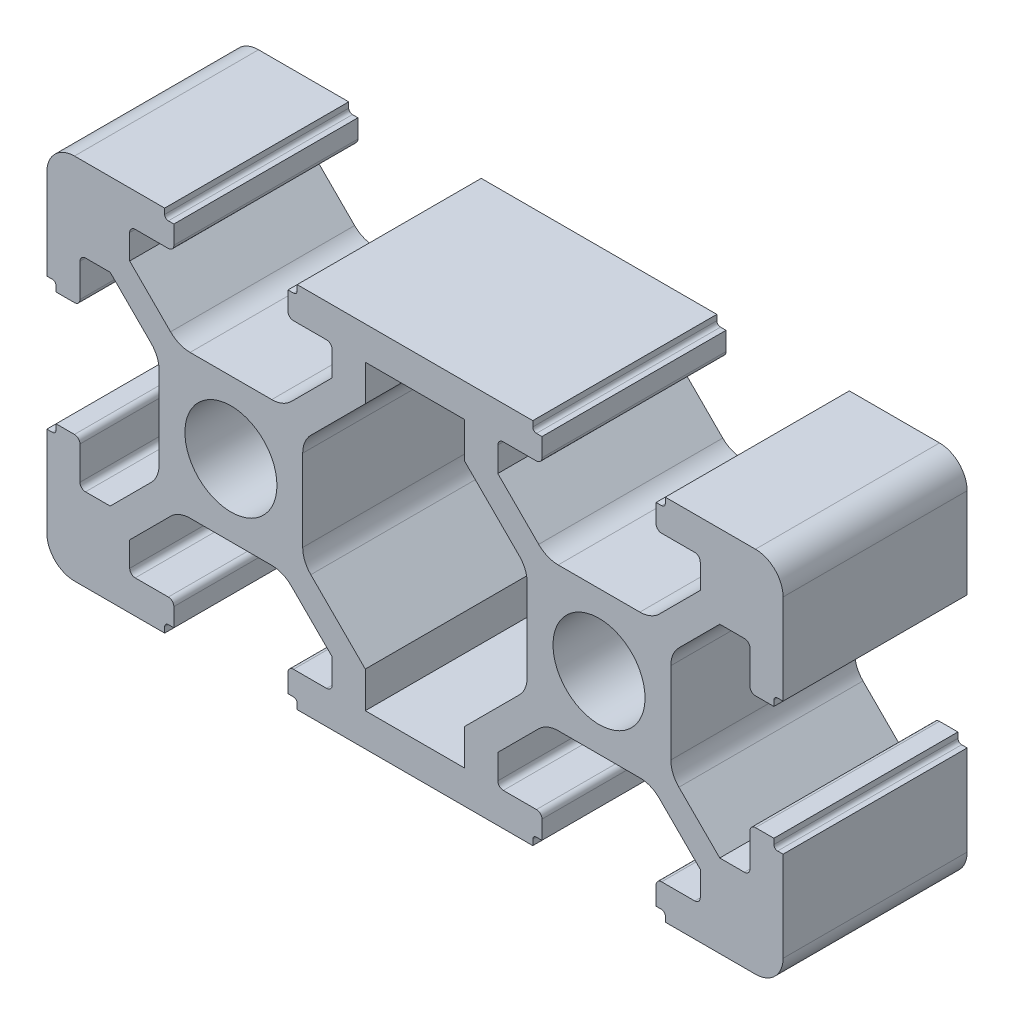
from build123d import *

# Parameters (mm, degrees)
SKETCH_1_R      = 2.5
EXTRUDE_1_DEPTH = 10


with BuildPart() as part:
    # 草图1 → 凸台-拉伸1 (new body)
    with BuildSketch(Plane.XY):
        with BuildLine():
            Line((-0.771587854, 9.545792426), (-5.671587854, 9.545792426))
            Line((-5.671587854, 9.545792426), (-5.671587854, 9.245792426))
            ThreePointArc((-5.671587854, 9.245792426), (-5.730166498, 9.10437107), (-5.871587854, 9.045792426))
            Line((-5.871587854, 9.045792426), (-6.171587854, 9.045792426))
            Line((-6.171587854, 9.045792426), (-6.171587854, 8.045792426))
            ThreePointArc((-6.171587854, 8.045792426), (-6.083719889, 7.833660392), (-5.871587854, 7.745792426))
            Line((-5.871587854, 7.745792426), (-4.071587854, 7.745792426))
            ThreePointArc((-4.071587854, 7.745792426), (-3.85945582, 7.657924461), (-3.771587854, 7.445792426))
            Line((-3.771587854, 7.445792426), (-3.771587854, 6.105792426))
            Line((-3.771587854, 6.105792426), (-5.992248026, 3.885132255))
            ThreePointArc((-5.992248026, 3.885132255), (-6.478883049, 3.559973128), (-7.052908198, 3.445792426))
            Line((-7.052908198, 3.445792426), (-11.490267511, 3.445792426))
            ThreePointArc((-11.490267511, 3.445792426), (-12.064292659, 3.559973128), (-12.550927682, 3.885132255))
            Line((-12.550927682, 3.885132255), (-14.771587854, 6.105792426))
            Line((-14.771587854, 6.105792426), (-14.771587854, 7.445792426))
            ThreePointArc((-14.771587854, 7.445792426), (-14.683719889, 7.657924461), (-14.471587854, 7.745792426))
            Line((-14.471587854, 7.745792426), (-12.671587854, 7.745792426))
            ThreePointArc((-12.671587854, 7.745792426), (-12.45945582, 7.833660392), (-12.371587854, 8.045792426))
            Line((-12.371587854, 8.045792426), (-12.371587854, 9.045792426))
            Line((-12.371587854, 9.045792426), (-12.671587854, 9.045792426))
            ThreePointArc((-12.671587854, 9.045792426), (-12.81300921, 9.10437107), (-12.871587854, 9.245792426))
            Line((-12.871587854, 9.245792426), (-12.871587854, 9.545792426))
            Line((-12.871587854, 9.545792426), (-17.771587854, 9.545792426))
            ThreePointArc((-17.771587854, 9.545792426), (-18.832248026, 9.106452598), (-19.271587854, 8.045792426))
            Line((-19.271587854, 8.045792426), (-19.271587854, 3.145792426))
            Line((-19.271587854, 3.145792426), (-18.971587854, 3.145792426))
            ThreePointArc((-18.971587854, 3.145792426), (-18.830166498, 3.087213783), (-18.771587854, 2.945792426))
            Line((-18.771587854, 2.945792426), (-18.771587854, 2.645792426))
            Line((-18.771587854, 2.645792426), (-17.771587854, 2.645792426))
            ThreePointArc((-17.771587854, 2.645792426), (-17.55945582, 2.733660392), (-17.471587854, 2.945792426))
            Line((-17.471587854, 2.945792426), (-17.471587854, 4.745792426))
            ThreePointArc((-17.471587854, 4.745792426), (-17.383719889, 4.957924461), (-17.171587854, 5.045792426))
            Line((-17.171587854, 5.045792426), (-15.831587854, 5.045792426))
            Line((-15.831587854, 5.045792426), (-13.610927682, 2.825132255))
            ThreePointArc((-13.610927682, 2.825132255), (-13.285768555, 2.338497231), (-13.171587854, 1.764472083))
            Line((-13.171587854, 1.764472083), (-13.171587854, -2.67288723))
            ThreePointArc((-13.171587854, -2.67288723), (-13.285768555, -3.246912379), (-13.610927682, -3.733547402))
            Line((-13.610927682, -3.733547402), (-15.831587854, -5.954207574))
            Line((-15.831587854, -5.954207574), (-17.171587854, -5.954207574))
            ThreePointArc((-17.171587854, -5.954207574), (-17.383719889, -5.866339608), (-17.471587854, -5.654207574))
            Line((-17.471587854, -5.654207574), (-17.471587854, -3.854207574))
            ThreePointArc((-17.471587854, -3.854207574), (-17.55945582, -3.642075539), (-17.771587854, -3.554207574))
            Line((-17.771587854, -3.554207574), (-18.771587854, -3.554207574))
            Line((-18.771587854, -3.554207574), (-18.771587854, -3.854207574))
            ThreePointArc((-18.771587854, -3.854207574), (-18.830166498, -3.99562893), (-18.971587854, -4.054207574))
            Line((-18.971587854, -4.054207574), (-19.271587854, -4.054207574))
            Line((-19.271587854, -4.054207574), (-19.271587854, -8.954207574))
            ThreePointArc((-19.271587854, -8.954207574), (-18.832248026, -10.014867745), (-17.771587854, -10.454207574))
            Line((-17.771587854, -10.454207574), (-12.871587854, -10.454207574))
            Line((-12.871587854, -10.454207574), (-12.871587854, -10.154207574))
            ThreePointArc((-12.871587854, -10.154207574), (-12.81300921, -10.012786217), (-12.671587854, -9.954207574))
            Line((-12.671587854, -9.954207574), (-12.371587854, -9.954207574))
            Line((-12.371587854, -9.954207574), (-12.371587854, -8.954207574))
            ThreePointArc((-12.371587854, -8.954207574), (-12.45945582, -8.742075539), (-12.671587854, -8.654207574))
            Line((-12.671587854, -8.654207574), (-14.471587854, -8.654207574))
            ThreePointArc((-14.471587854, -8.654207574), (-14.683719889, -8.566339608), (-14.771587854, -8.354207574))
            Line((-14.771587854, -8.354207574), (-14.771587854, -7.014207574))
            Line((-14.771587854, -7.014207574), (-12.550927682, -4.793547402))
            ThreePointArc((-12.550927682, -4.793547402), (-12.064292659, -4.468388275), (-11.490267511, -4.354207574))
            Line((-11.490267511, -4.354207574), (-7.052908198, -4.354207574))
            ThreePointArc((-7.052908198, -4.354207574), (-6.478883049, -4.468388275), (-5.992248026, -4.793547402))
            Line((-5.992248026, -4.793547402), (-3.771587854, -7.014207574))
            Line((-3.771587854, -7.014207574), (-3.771587854, -8.354207574))
            ThreePointArc((-3.771587854, -8.354207574), (-3.85945582, -8.566339608), (-4.071587854, -8.654207574))
            Line((-4.071587854, -8.654207574), (-5.871587854, -8.654207574))
            ThreePointArc((-5.871587854, -8.654207574), (-6.083719889, -8.742075539), (-6.171587854, -8.954207574))
            Line((-6.171587854, -8.954207574), (-6.171587854, -9.954207574))
            Line((-6.171587854, -9.954207574), (-5.871587854, -9.954207574))
            ThreePointArc((-5.871587854, -9.954207574), (-5.730166498, -10.012786217), (-5.671587854, -10.154207574))
            Line((-5.671587854, -10.154207574), (-5.671587854, -10.454207574))
            Line((-5.671587854, -10.454207574), (-0.771587854, -10.454207574))
            Line((-0.771587854, -10.454207574), (7.128412146, -10.454207574))
            Line((7.128412146, -10.454207574), (7.128412146, -10.154207574))
            ThreePointArc((7.128412146, -10.154207574), (7.18699079, -10.012786217), (7.328412146, -9.954207574))
            Line((7.328412146, -9.954207574), (7.628412146, -9.954207574))
            Line((7.628412146, -9.954207574), (7.628412146, -8.954207574))
            ThreePointArc((7.628412146, -8.954207574), (7.54054418, -8.742075539), (7.328412146, -8.654207574))
            Line((7.328412146, -8.654207574), (5.528412146, -8.654207574))
            ThreePointArc((5.528412146, -8.654207574), (5.316280111, -8.566339608), (5.228412146, -8.354207574))
            Line((5.228412146, -8.354207574), (5.228412146, -7.014207574))
            Line((5.228412146, -7.014207574), (7.449072318, -4.793547402))
            ThreePointArc((7.449072318, -4.793547402), (7.935707341, -4.468388275), (8.509732489, -4.354207574))
            Line((8.509732489, -4.354207574), (12.947091802, -4.354207574))
            ThreePointArc((12.947091802, -4.354207574), (13.521116951, -4.468388275), (14.007751974, -4.793547402))
            Line((14.007751974, -4.793547402), (16.228412146, -7.014207574))
            Line((16.228412146, -7.014207574), (16.228412146, -8.354207574))
            ThreePointArc((16.228412146, -8.354207574), (16.14054418, -8.566339608), (15.928412146, -8.654207574))
            Line((15.928412146, -8.654207574), (14.128412146, -8.654207574))
            ThreePointArc((14.128412146, -8.654207574), (13.916280111, -8.742075539), (13.828412146, -8.954207574))
            Line((13.828412146, -8.954207574), (13.828412146, -9.954207574))
            Line((13.828412146, -9.954207574), (14.128412146, -9.954207574))
            ThreePointArc((14.128412146, -9.954207574), (14.269833502, -10.012786217), (14.328412146, -10.154207574))
            Line((14.328412146, -10.154207574), (14.328412146, -10.454207574))
            Line((14.328412146, -10.454207574), (19.228412146, -10.454207574))
            ThreePointArc((19.228412146, -10.454207574), (20.289072318, -10.014867745), (20.728412146, -8.954207574))
            Line((20.728412146, -8.954207574), (20.728412146, -4.054207574))
            Line((20.728412146, -4.054207574), (20.428412146, -4.054207574))
            ThreePointArc((20.428412146, -4.054207574), (20.28699079, -3.99562893), (20.228412146, -3.854207574))
            Line((20.228412146, -3.854207574), (20.228412146, -3.554207574))
            Line((20.228412146, -3.554207574), (19.228412146, -3.554207574))
            ThreePointArc((19.228412146, -3.554207574), (19.016280111, -3.642075539), (18.928412146, -3.854207574))
            Line((18.928412146, -3.854207574), (18.928412146, -5.654207574))
            ThreePointArc((18.928412146, -5.654207574), (18.84054418, -5.866339608), (18.628412146, -5.954207574))
            Line((18.628412146, -5.954207574), (17.288412146, -5.954207574))
            Line((17.288412146, -5.954207574), (15.067751974, -3.733547402))
            ThreePointArc((15.067751974, -3.733547402), (14.742592847, -3.246912379), (14.628412146, -2.67288723))
            Line((14.628412146, -2.67288723), (14.628412146, 1.764472083))
            ThreePointArc((14.628412146, 1.764472083), (14.742592847, 2.338497231), (15.067751974, 2.825132255))
            Line((15.067751974, 2.825132255), (17.288412146, 5.045792426))
            Line((17.288412146, 5.045792426), (18.628412146, 5.045792426))
            ThreePointArc((18.628412146, 5.045792426), (18.84054418, 4.957924461), (18.928412146, 4.745792426))
            Line((18.928412146, 4.745792426), (18.928412146, 2.945792426))
            ThreePointArc((18.928412146, 2.945792426), (19.016280111, 2.733660392), (19.228412146, 2.645792426))
            Line((19.228412146, 2.645792426), (20.228412146, 2.645792426))
            Line((20.228412146, 2.645792426), (20.228412146, 2.945792426))
            ThreePointArc((20.228412146, 2.945792426), (20.28699079, 3.087213783), (20.428412146, 3.145792426))
            Line((20.428412146, 3.145792426), (20.728412146, 3.145792426))
            Line((20.728412146, 3.145792426), (20.728412146, 8.045792426))
            ThreePointArc((20.728412146, 8.045792426), (20.289072318, 9.106452598), (19.228412146, 9.545792426))
            Line((19.228412146, 9.545792426), (14.328412146, 9.545792426))
            Line((14.328412146, 9.545792426), (14.328412146, 9.245792426))
            ThreePointArc((14.328412146, 9.245792426), (14.269833502, 9.10437107), (14.128412146, 9.045792426))
            Line((14.128412146, 9.045792426), (13.828412146, 9.045792426))
            Line((13.828412146, 9.045792426), (13.828412146, 8.045792426))
            ThreePointArc((13.828412146, 8.045792426), (13.916280111, 7.833660392), (14.128412146, 7.745792426))
            Line((14.128412146, 7.745792426), (15.928412146, 7.745792426))
            ThreePointArc((15.928412146, 7.745792426), (16.14054418, 7.657924461), (16.228412146, 7.445792426))
            Line((16.228412146, 7.445792426), (16.228412146, 6.105792426))
            Line((16.228412146, 6.105792426), (14.007751974, 3.885132255))
            ThreePointArc((14.007751974, 3.885132255), (13.521116951, 3.559973128), (12.947091802, 3.445792426))
            Line((12.947091802, 3.445792426), (8.509732489, 3.445792426))
            ThreePointArc((8.509732489, 3.445792426), (7.935707341, 3.559973128), (7.449072318, 3.885132255))
            Line((7.449072318, 3.885132255), (5.228412146, 6.105792426))
            Line((5.228412146, 6.105792426), (5.228412146, 7.445792426))
            ThreePointArc((5.228412146, 7.445792426), (5.316280111, 7.657924461), (5.528412146, 7.745792426))
            Line((5.528412146, 7.745792426), (7.328412146, 7.745792426))
            ThreePointArc((7.328412146, 7.745792426), (7.54054418, 7.833660392), (7.628412146, 8.045792426))
            Line((7.628412146, 8.045792426), (7.628412146, 9.045792426))
            Line((7.628412146, 9.045792426), (7.328412146, 9.045792426))
            ThreePointArc((7.328412146, 9.045792426), (7.18699079, 9.10437107), (7.128412146, 9.245792426))
            Line((7.128412146, 9.245792426), (7.128412146, 9.545792426))
            Line((7.128412146, 9.545792426), (2.228412146, 9.545792426))
            Line((2.228412146, 9.545792426), (-0.771587854, 9.545792426))
        make_face()
        with Locations((10.728412146, -0.454207574)):
            Circle(SKETCH_1_R, mode=Mode.SUBTRACT)
        with Locations((-9.271587854, -0.454207574)):
            Circle(SKETCH_1_R, mode=Mode.SUBTRACT)
        with BuildLine():
            Line((-1.971587854, -6.694207574), (-4.932248026, -3.733547402))
            ThreePointArc((-4.932248026, -3.733547402), (-5.257407153, -3.246912379), (-5.371587854, -2.67288723))
            Line((-5.371587854, -2.67288723), (-5.371587854, 1.764472083))
            ThreePointArc((-5.371587854, 1.764472083), (-5.257407153, 2.338497231), (-4.932248026, 2.825132255))
            Line((-4.932248026, 2.825132255), (-1.971587854, 5.785792426))
            Line((-1.971587854, 5.785792426), (-1.971587854, 7.745792426))
            Line((-1.971587854, 7.745792426), (3.428412146, 7.745792426))
            Line((3.428412146, 7.745792426), (3.428412146, 5.785792426))
            Line((3.428412146, 5.785792426), (6.389072318, 2.825132255))
            ThreePointArc((6.389072318, 2.825132255), (6.714231445, 2.338497231), (6.828412146, 1.764472083))
            Line((6.828412146, 1.764472083), (6.828412146, -2.67288723))
            ThreePointArc((6.828412146, -2.67288723), (6.714231445, -3.246912379), (6.389072318, -3.733547402))
            Line((6.389072318, -3.733547402), (3.428412146, -6.694207574))
            Line((3.428412146, -6.694207574), (3.428412146, -8.654207574))
            Line((3.428412146, -8.654207574), (-1.971587854, -8.654207574))
            Line((-1.971587854, -8.654207574), (-1.971587854, -6.694207574))
        make_face(mode=Mode.SUBTRACT)
    extrude(amount=EXTRUDE_1_DEPTH)


solid = part.part
